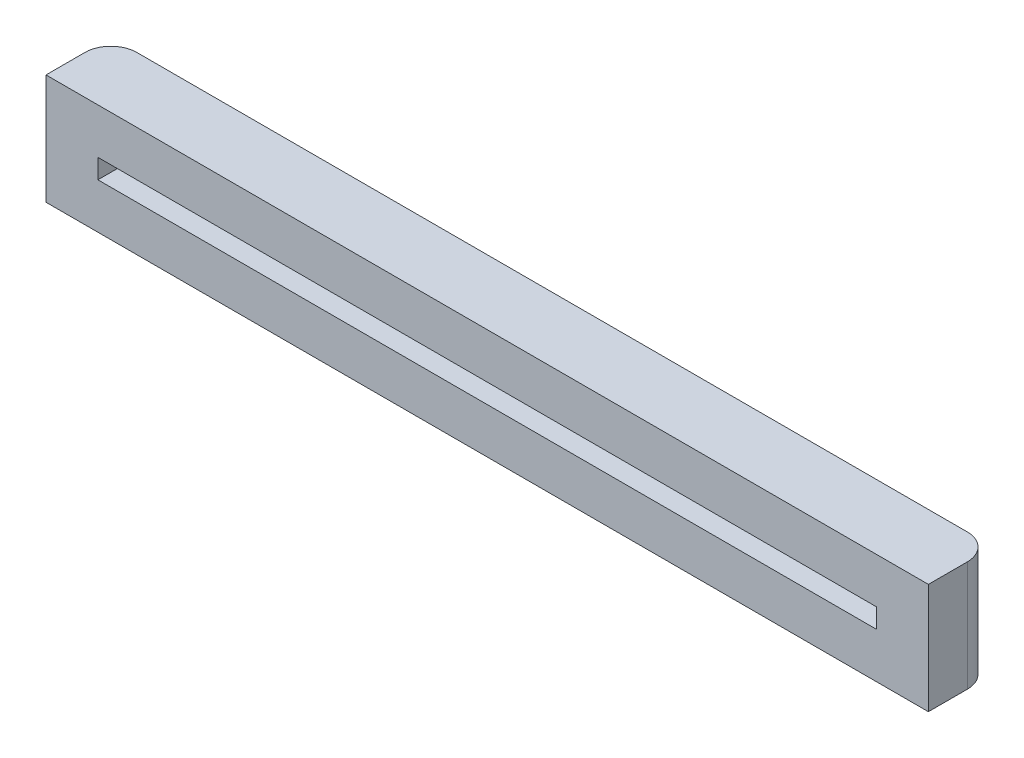
from build123d import *

# Parameters (mm, degrees)
SKETCH1_W           = 68
SKETCH1_H           = 8.5
BOSS_EXTRUDE1_DEPTH = 5
SKETCH2_W           = 60
SKETCH2_H           = 1.5
CUT_EXTRUDE1_DEPTH  = 3
FILLET1_R           = 2


with BuildPart() as part:
    # Sketch1 → Boss-Extrude1 (new body)
    with BuildSketch(Plane.XY):
        with Locations((34, 4.25)):
            Rectangle(SKETCH1_W, SKETCH1_H)
    extrude(amount=BOSS_EXTRUDE1_DEPTH)

    # Sketch2 → Cut-Extrude1 (cut)
    with BuildSketch(Plane.XY.offset(5)):
        with Locations((34, 4.25)):
            Rectangle(SKETCH2_W, SKETCH2_H)
    extrude(amount=-CUT_EXTRUDE1_DEPTH, mode=Mode.SUBTRACT)

    # Fillet1
    fillet1_edges = [part.edges().sort_by_distance(p)[0] for p in [
        (68, 4.25, 0),
        (0, 4.25, 0),
    ]]
    fillet(fillet1_edges, radius=FILLET1_R)


solid = part.part
